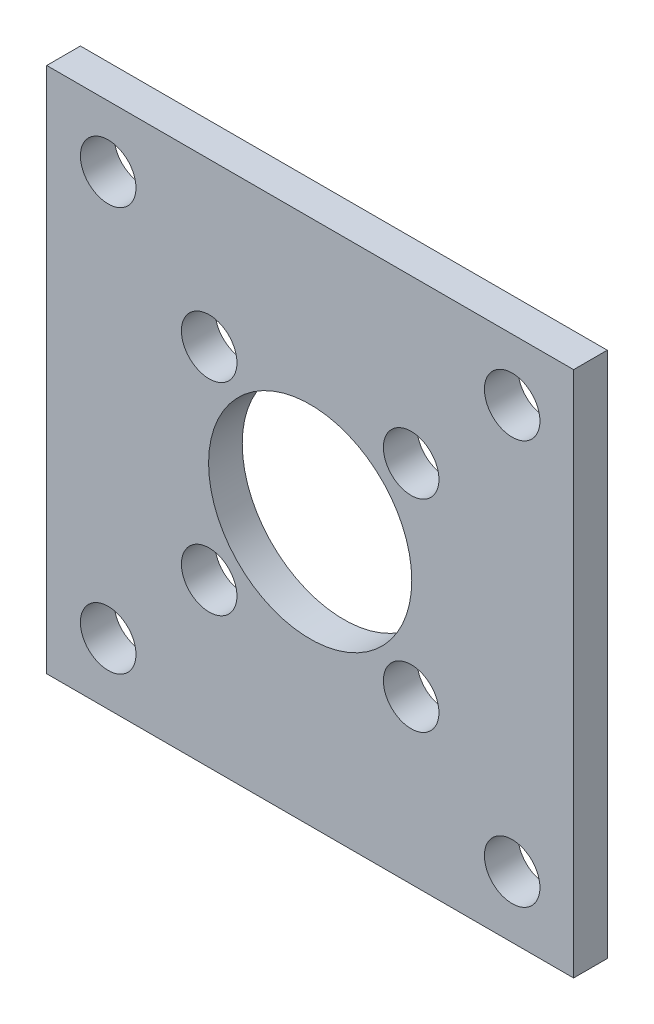
from build123d import *

# Parameters (mm, degrees)
SKETCH1_W           = 78.25
SKETCH1_H           = 78.25
SKETCH1_R           = 4.125
SKETCH1_R_2         = 15.088203436
BOSS_EXTRUDE1_DEPTH = 5


with BuildPart() as part:
    # Sketch1 → Boss-Extrude1 (new body)
    with BuildSketch(Plane.XY):
        with Locations((39.125, 39.125)):
            Rectangle(SKETCH1_W, SKETCH1_H)
        with Locations((9.125, 9.125)):
            Circle(SKETCH1_R, mode=Mode.SUBTRACT)
        with Locations((69.125, 9.125)):
            Circle(SKETCH1_R, mode=Mode.SUBTRACT)
        with Locations((69.125, 69.125)):
            Circle(SKETCH1_R, mode=Mode.SUBTRACT)
        with Locations((39.125, 39.125)):
            Circle(SKETCH1_R_2, mode=Mode.SUBTRACT)
        with Locations((9.125, 69.125)):
            Circle(SKETCH1_R, mode=Mode.SUBTRACT)
        with Locations((24.125, 24.125)):
            Circle(SKETCH1_R, mode=Mode.SUBTRACT)
        with Locations((54.125, 24.125)):
            Circle(SKETCH1_R, mode=Mode.SUBTRACT)
        with Locations((24.125, 54.125)):
            Circle(SKETCH1_R, mode=Mode.SUBTRACT)
        with Locations((54.125, 54.125)):
            Circle(SKETCH1_R, mode=Mode.SUBTRACT)
    extrude(amount=BOSS_EXTRUDE1_DEPTH)


solid = part.part
